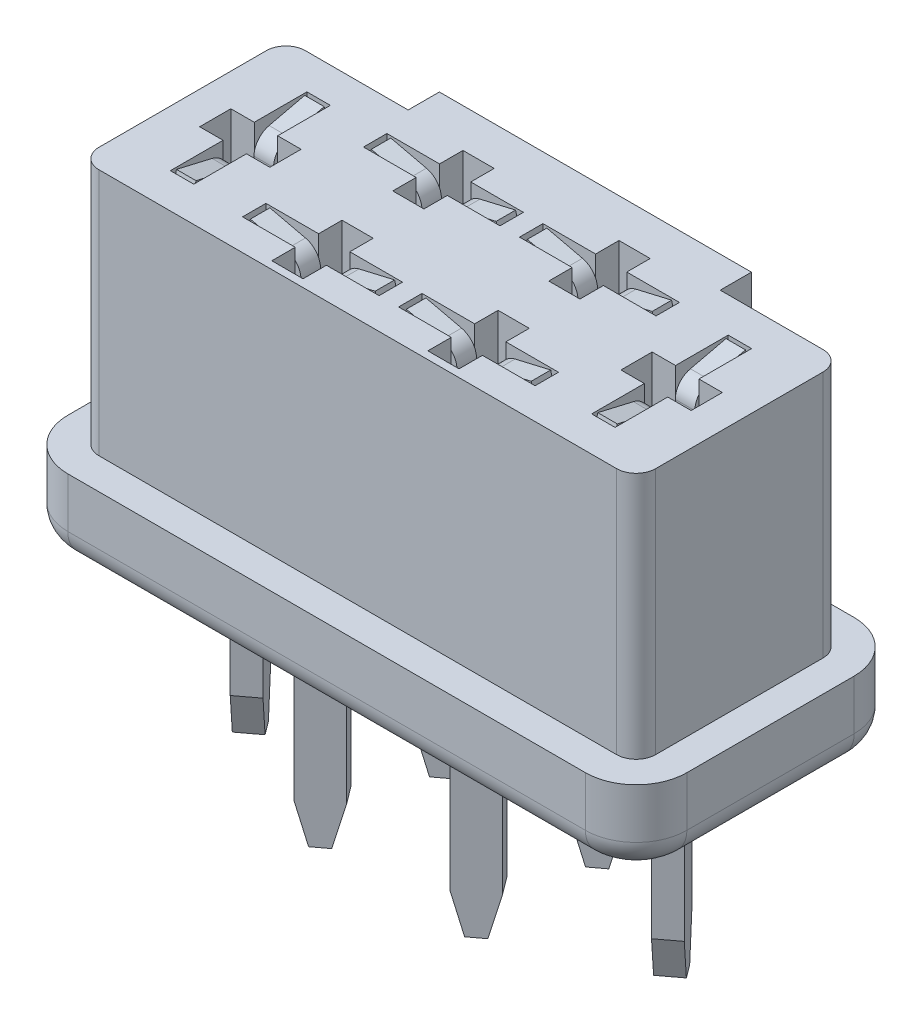
from build123d import *
from OCP.BRepFilletAPI import BRepFilletAPI_MakeChamfer

# Parameters (mm, degrees)
SKETCH1_W            = 15.87
SKETCH1_H            = 6.89
BOSS_EXTRUDE1_DEPTH  = 8.38
FILLET1_R            = 1.3
FILLET2_R            = 0.75
SKETCH2_OUTSIDE_W    = 21.714
SKETCH2_OUTSIDE_H    = 12.734
CUT_EXTRUDE1_DEPTH   = 6.35
CUT_EXTRUDE2_DEPTH   = 3
BOSS_EXTRUDE2_DEPTH  = 4.69
CHAMFER1_SIZE        = 1
CHAMFER1_SIZE2       = 0.267949192
BOSS_EXTRUDE3_DEPTH  = 0.25
MIRROR2_COPY_1_DEPTH = 0.25
BOSS_EXTRUDE4_DEPTH  = 0.25
SKETCH8_W            = 0.769230769
SKETCH8_H            = 0.205128205
BOSS_EXTRUDE5_DEPTH  = 0.15


with BuildPart() as part:
    # Sketch1 → Boss-Extrude1 (new body)
    with BuildSketch(Plane(origin=(0, 0, 0), x_dir=(1, 0, 0), z_dir=(0, 1, 0))):
        Rectangle(SKETCH1_W, SKETCH1_H)
    extrude(amount=BOSS_EXTRUDE1_DEPTH)

    # Fillet1
    fillet1_edges = [part.edges().sort_by_distance(p)[0] for p in [
        (7.935, 4.19, 3.445),
        (-7.935, 4.19, 3.445),
        (-7.935, 4.19, -3.445),
        (7.935, 4.19, -3.445),
    ]]
    fillet(fillet1_edges, radius=FILLET1_R)

    # Fillet2
    fillet2_edges = [part.edges().sort_by_distance(p)[0] for p in [
        (0, 0, 3.445),
        (7.935, 0, 0),
        (-7.935, 0, 0),
        (0, 0, -3.445),
        (7.554238816, 0, 3.064238816),
        (7.554238816, 0, -3.064238816),
        (-7.554238816, 0, -3.064238816),
        (-7.554238816, 0, 3.064238816),
    ]]
    fillet(fillet2_edges, radius=FILLET2_R)

    # Sketch2 outside → Cut-Extrude1 (cut)
    with BuildSketch(Plane(origin=(0, 8.38, 0), x_dir=(1, 0, 0), z_dir=(0, 1, 0))):
        Rectangle(SKETCH2_OUTSIDE_W, SKETCH2_OUTSIDE_H)
        with BuildLine():
            Line((4, 2.645), (4, 3.445))
            Line((4, 3.445), (-4, 3.445))
            Line((-4, 3.445), (-4, 2.645))
            Line((-4, 2.645), (-6.635, 2.645))
            ThreePointArc((-6.635, 2.645), (-6.988553391, 2.498553391), (-7.135, 2.145))
            Line((-7.135, 2.145), (-7.135, -2.145))
            ThreePointArc((-7.135, -2.145), (-6.988553391, -2.498553391), (-6.635, -2.645))
            Line((-6.635, -2.645), (6.635, -2.645))
            ThreePointArc((6.635, -2.645), (6.988553391, -2.498553391), (7.135, -2.145))
            Line((7.135, -2.145), (7.135, 2.145))
            ThreePointArc((7.135, 2.145), (6.988553391, 2.498553391), (6.635, 2.645))
            Line((6.635, 2.645), (4, 2.645))
        make_face(mode=Mode.SUBTRACT)
    extrude(amount=-CUT_EXTRUDE1_DEPTH, mode=Mode.SUBTRACT)

    # Sketch3 → Cut-Extrude2 (cut)
    with BuildSketch(Plane(origin=(0, 8.38, 0), x_dir=(1, 0, 0), z_dir=(0, 1, 0))):
        Polygon((-2.4, -0.65), (-2.4, -1.25), (-3.75, -1.25), (-3.75, -1.85), (-2.4, -1.85), (-2.4, -2.45), (-1.6, -2.45), (-1.6, -1.85), (-0.25, -1.85), (-0.25, -1.25), (-1.6, -1.25), (-1.6, -0.65), align=None)
        Polygon((1.6, -0.65), (2.4, -0.65), (2.4, -1.25), (3.75, -1.25), (3.75, -1.85), (2.4, -1.85), (2.4, -2.45), (1.6, -2.45), (1.6, -1.85), (0.25, -1.85), (0.25, -1.25), (1.6, -1.25), align=None)
        Polygon((2.4, 0.65), (2.4, 1.25), (3.75, 1.25), (3.75, 1.85), (2.4, 1.85), (2.4, 2.45), (1.6, 2.45), (1.6, 1.85), (0.25, 1.85), (0.25, 1.25), (1.6, 1.25), (1.6, 0.65), align=None)
        Polygon((-1.6, 0.65), (-2.4, 0.65), (-2.4, 1.25), (-3.75, 1.25), (-3.75, 1.85), (-2.4, 1.85), (-2.4, 2.45), (-1.6, 2.45), (-1.6, 1.85), (-0.25, 1.85), (-0.25, 1.25), (-1.6, 1.25), align=None)
        Polygon((-5.7, 1.75), (-5.1, 1.75), (-5.1, 0.4), (-4.5, 0.4), (-4.5, -0.4), (-5.1, -0.4), (-5.1, -1.75), (-5.7, -1.75), (-5.7, -0.4), (-6.3, -0.4), (-6.3, 0.4), (-5.7, 0.4), align=None)
        Polygon((5.7, 0.4), (5.7, 1.75), (5.1, 1.75), (5.1, 0.4), (4.5, 0.4), (4.5, -0.4), (5.1, -0.4), (5.1, -1.75), (5.7, -1.75), (5.7, -0.4), (6.3, -0.4), (6.3, 0.4), align=None)
    extrude(amount=-CUT_EXTRUDE2_DEPTH, mode=Mode.SUBTRACT)

    # Sketch5 → Boss-Extrude2 (add)
    with BuildSketch(Plane.XZ):
        Polygon((-5.928, -0.204), (-5.352, 0.564), (-4.872, 0.204), (-5.448, -0.564), align=None)
        Polygon((-2.204, -1.022), (-1.436, -1.598), (-1.796, -2.078), (-2.564, -1.502), align=None)
        Polygon((-2.204, 2.078), (-1.436, 1.502), (-1.796, 1.022), (-2.564, 1.598), align=None)
        Polygon((1.796, 2.078), (2.564, 1.502), (2.204, 1.022), (1.436, 1.598), align=None)
        Polygon((1.796, -1.022), (2.564, -1.598), (2.204, -2.078), (1.436, -1.502), align=None)
        Polygon((4.872, -0.204), (5.448, 0.564), (5.928, 0.204), (5.352, -0.564), align=None)
    extrude(amount=BOSS_EXTRUDE2_DEPTH)

    # Chamfer1: one chamfer whose edges measure the first distance from different faces: ONE call of the kernel's chamfer builder (chamfer() names one face for all edges)
    chamfer1_edges_1 = [part.edges().sort_by_distance(p)[0] for p in [
        (-5.688, -4.69, -0.384),
    ]]
    chamfer1_side_1 = [part.faces().sort_by_distance(p)[0] for p in [
        (-5.688, -2.345, -0.384),
    ]]
    chamfer1_edges_2 = [part.edges().sort_by_distance(p)[0] for p in [
        (-5.112, -4.69, 0.384),
    ]]
    chamfer1_side_2 = [part.faces().sort_by_distance(p)[0] for p in [
        (-5.112, -2.345, 0.384),
    ]]
    chamfer1_edges_3 = [part.edges().sort_by_distance(p)[0] for p in [
        (-2.384, -4.69, -1.262),
    ]]
    chamfer1_side_3 = [part.faces().sort_by_distance(p)[0] for p in [
        (-2.384, -2.345, -1.262),
    ]]
    chamfer1_edges_4 = [part.edges().sort_by_distance(p)[0] for p in [
        (-1.616, -4.69, -1.838),
    ]]
    chamfer1_side_4 = [part.faces().sort_by_distance(p)[0] for p in [
        (-1.616, -2.345, -1.838),
    ]]
    chamfer1_edges_5 = [part.edges().sort_by_distance(p)[0] for p in [
        (-2.384, -4.69, 1.838),
    ]]
    chamfer1_side_5 = [part.faces().sort_by_distance(p)[0] for p in [
        (-2.384, -2.345, 1.838),
    ]]
    chamfer1_edges_6 = [part.edges().sort_by_distance(p)[0] for p in [
        (-1.616, -4.69, 1.262),
    ]]
    chamfer1_side_6 = [part.faces().sort_by_distance(p)[0] for p in [
        (-1.616, -2.345, 1.262),
    ]]
    chamfer1_edges_7 = [part.edges().sort_by_distance(p)[0] for p in [
        (1.616, -4.69, 1.838),
    ]]
    chamfer1_side_7 = [part.faces().sort_by_distance(p)[0] for p in [
        (1.616, -2.345, 1.838),
    ]]
    chamfer1_edges_8 = [part.edges().sort_by_distance(p)[0] for p in [
        (2.384, -4.69, 1.262),
    ]]
    chamfer1_side_8 = [part.faces().sort_by_distance(p)[0] for p in [
        (2.384, -2.345, 1.262),
    ]]
    chamfer1_edges_9 = [part.edges().sort_by_distance(p)[0] for p in [
        (1.616, -4.69, -1.262),
    ]]
    chamfer1_side_9 = [part.faces().sort_by_distance(p)[0] for p in [
        (1.616, -2.345, -1.262),
    ]]
    chamfer1_edges_10 = [part.edges().sort_by_distance(p)[0] for p in [
        (2.384, -4.69, -1.838),
    ]]
    chamfer1_side_10 = [part.faces().sort_by_distance(p)[0] for p in [
        (2.384, -2.345, -1.838),
    ]]
    chamfer1_edges_11 = [part.edges().sort_by_distance(p)[0] for p in [
        (5.112, -4.69, -0.384),
    ]]
    chamfer1_side_11 = [part.faces().sort_by_distance(p)[0] for p in [
        (5.112, -2.345, -0.384),
    ]]
    chamfer1_edges_12 = [part.edges().sort_by_distance(p)[0] for p in [
        (5.688, -4.69, 0.384),
    ]]
    chamfer1_side_12 = [part.faces().sort_by_distance(p)[0] for p in [
        (5.688, -2.345, 0.384),
    ]]
    chamfer1 = BRepFilletAPI_MakeChamfer(part.part.solid().wrapped)
    for e in chamfer1_edges_1:
        chamfer1.Add(CHAMFER1_SIZE, CHAMFER1_SIZE2, e.wrapped, chamfer1_side_1[0].wrapped)  # the first distance lies on this face
    for e in chamfer1_edges_2:
        chamfer1.Add(CHAMFER1_SIZE, CHAMFER1_SIZE2, e.wrapped, chamfer1_side_2[0].wrapped)  # the first distance lies on this face
    for e in chamfer1_edges_3:
        chamfer1.Add(CHAMFER1_SIZE, CHAMFER1_SIZE2, e.wrapped, chamfer1_side_3[0].wrapped)  # the first distance lies on this face
    for e in chamfer1_edges_4:
        chamfer1.Add(CHAMFER1_SIZE, CHAMFER1_SIZE2, e.wrapped, chamfer1_side_4[0].wrapped)  # the first distance lies on this face
    for e in chamfer1_edges_5:
        chamfer1.Add(CHAMFER1_SIZE, CHAMFER1_SIZE2, e.wrapped, chamfer1_side_5[0].wrapped)  # the first distance lies on this face
    for e in chamfer1_edges_6:
        chamfer1.Add(CHAMFER1_SIZE, CHAMFER1_SIZE2, e.wrapped, chamfer1_side_6[0].wrapped)  # the first distance lies on this face
    for e in chamfer1_edges_7:
        chamfer1.Add(CHAMFER1_SIZE, CHAMFER1_SIZE2, e.wrapped, chamfer1_side_7[0].wrapped)  # the first distance lies on this face
    for e in chamfer1_edges_8:
        chamfer1.Add(CHAMFER1_SIZE, CHAMFER1_SIZE2, e.wrapped, chamfer1_side_8[0].wrapped)  # the first distance lies on this face
    for e in chamfer1_edges_9:
        chamfer1.Add(CHAMFER1_SIZE, CHAMFER1_SIZE2, e.wrapped, chamfer1_side_9[0].wrapped)  # the first distance lies on this face
    for e in chamfer1_edges_10:
        chamfer1.Add(CHAMFER1_SIZE, CHAMFER1_SIZE2, e.wrapped, chamfer1_side_10[0].wrapped)  # the first distance lies on this face
    for e in chamfer1_edges_11:
        chamfer1.Add(CHAMFER1_SIZE, CHAMFER1_SIZE2, e.wrapped, chamfer1_side_11[0].wrapped)  # the first distance lies on this face
    for e in chamfer1_edges_12:
        chamfer1.Add(CHAMFER1_SIZE, CHAMFER1_SIZE2, e.wrapped, chamfer1_side_12[0].wrapped)  # the first distance lies on this face
    add(Compound.cast(chamfer1.Shape()), mode=Mode.REPLACE)

    # Sketch6 → Boss-Extrude3 (add, symmetric)
    with BuildSketch(Plane(origin=(0, 0, -1.55), x_dir=(-1, 0, 0), z_dir=(0, 0, -1))):
        with BuildLine():
            Line((-2.3, 5.68), (-1.7, 5.68))
            Line((-1.7, 5.68), (-1.7, 7.68))
            ThreePointArc((-1.7, 7.68), (-1.591652135, 7.990819249), (-1.313565578, 8.166932089))
            Line((-1.313565578, 8.166932089), (-0.4, 8.38))
            Line((-0.4, 8.38), (-0.331860653, 8.087840746))
            Line((-0.331860653, 8.087840746), (-1.245426231, 7.874772836))
            ThreePointArc((-1.245426231, 7.874772836), (-1.356660854, 7.8043277), (-1.4, 7.68))
            Line((-1.4, 7.68), (-1.4, 5.38))
            Line((-1.4, 5.38), (-2.6, 5.38))
            Line((-2.6, 5.38), (-2.6, 7.68))
            ThreePointArc((-2.6, 7.68), (-2.643339146, 7.8043277), (-2.754573769, 7.874772836))
            Line((-2.754573769, 7.874772836), (-3.668139347, 8.087840746))
            Line((-3.668139347, 8.087840746), (-3.6, 8.38))
            Line((-3.6, 8.38), (-2.686434422, 8.166932089))
            ThreePointArc((-2.686434422, 8.166932089), (-2.408347865, 7.990819249), (-2.3, 7.68))
            Line((-2.3, 7.68), (-2.3, 5.68))
        make_face()
    boss_extrude3 = extrude(amount=BOSS_EXTRUDE3_DEPTH, both=True)

    # Mirror1: Boss-Extrude3 across plane
    add(boss_extrude3.mirror(Plane(origin=(0, 0, 0), x_dir=(0, 0, 1), z_dir=(1, 0, 0))))

    # Mirror2: Boss-Extrude3 across plane
    add(boss_extrude3.mirror(Plane.XY))

    # Mirror2 copy 1 sketch → Mirror2 copy 1 (add, symmetric)
    with BuildSketch(Plane.XY.offset(1.55)):
        with BuildLine():
            Line((-2.3, 5.68), (-1.7, 5.68))
            Line((-1.7, 5.68), (-1.7, 7.68))
            ThreePointArc((-1.7, 7.68), (-1.591652135, 7.990819249), (-1.313565578, 8.166932089))
            Line((-1.313565578, 8.166932089), (-0.4, 8.38))
            Line((-0.4, 8.38), (-0.331860653, 8.087840746))
            Line((-0.331860653, 8.087840746), (-1.245426231, 7.874772836))
            ThreePointArc((-1.245426231, 7.874772836), (-1.356660854, 7.8043277), (-1.4, 7.68))
            Line((-1.4, 7.68), (-1.4, 5.38))
            Line((-1.4, 5.38), (-2.6, 5.38))
            Line((-2.6, 5.38), (-2.6, 7.68))
            ThreePointArc((-2.6, 7.68), (-2.643339146, 7.8043277), (-2.754573769, 7.874772836))
            Line((-2.754573769, 7.874772836), (-3.668139347, 8.087840746))
            Line((-3.668139347, 8.087840746), (-3.6, 8.38))
            Line((-3.6, 8.38), (-2.686434422, 8.166932089))
            ThreePointArc((-2.686434422, 8.166932089), (-2.408347865, 7.990819249), (-2.3, 7.68))
            Line((-2.3, 7.68), (-2.3, 5.68))
        make_face()
    extrude(amount=MIRROR2_COPY_1_DEPTH, both=True)

    # Sketch7 → Boss-Extrude4 (add, symmetric)
    with BuildSketch(Plane.ZY.offset(5.4)):
        with BuildLine():
            Line((-0.34356411, 5.68), (0.34356411, 5.68))
            Line((0.34356411, 5.68), (0.34356411, 7.68))
            ThreePointArc((0.34356411, 7.68), (0.451911976, 7.990819249), (0.729998532, 8.166932089))
            Line((0.729998532, 8.166932089), (1.64356411, 8.38))
            Line((1.64356411, 8.38), (1.711703457, 8.087840746))
            Line((1.711703457, 8.087840746), (0.798137879, 7.874772836))
            ThreePointArc((0.798137879, 7.874772836), (0.686903256, 7.8043277), (0.64356411, 7.68))
            Line((0.64356411, 7.68), (0.64356411, 5.38))
            Line((0.64356411, 5.38), (-0.64356411, 5.38))
            Line((-0.64356411, 5.38), (-0.64356411, 7.68))
            ThreePointArc((-0.64356411, 7.68), (-0.686903256, 7.8043277), (-0.798137879, 7.874772836))
            Line((-0.798137879, 7.874772836), (-1.711703457, 8.087840746))
            Line((-1.711703457, 8.087840746), (-1.64356411, 8.38))
            Line((-1.64356411, 8.38), (-0.729998532, 8.166932089))
            ThreePointArc((-0.729998532, 8.166932089), (-0.451911976, 7.990819249), (-0.34356411, 7.68))
            Line((-0.34356411, 7.68), (-0.34356411, 5.68))
        make_face()
    boss_extrude4 = extrude(amount=BOSS_EXTRUDE4_DEPTH, both=True)

    # Mirror3: Boss-Extrude4 across plane
    add(boss_extrude4.mirror(Plane(origin=(0, 0, 0), x_dir=(0, 0, 1), z_dir=(1, 0, 0))))

    # Sketch8 → Boss-Extrude5 (add)
    # profile 1 of 5: a face of its own
    with BuildSketch(Plane.XZ):
        with Locations((-5.483370513, 1.487427858)):
            Rectangle(SKETCH8_W, SKETCH8_H)
    # profile 2 of 5: a face of its own
    with BuildSketch(Plane.XZ):
        Polygon((5.442706084, 1.533944278), (5.442706084, 1.976251971), (5.577321469, 1.976251971), (5.577321469, 1.533944278), (6.019629161, 1.533944278), (6.019629161, 1.399328894), (5.577321469, 1.399328894), (5.577321469, 0.957021201), (5.442706084, 0.957021201), (5.442706084, 1.399328894), (5.000398392, 1.399328894), (5.000398392, 1.533944278), align=None)
    # profile 3 of 5: a face of its own
    with BuildSketch(Plane.XZ):
        Polygon((-0.685537905, 2.086538462), (0.814462095, 1.888521635), (0.814462095, 1.869290865), (-0.416307136, 1.25), (0.814462095, 0.632211538), (0.814462095, 0.612680288), (-0.685537905, 0.413461538), (-0.685537905, 0.548677885), (0.393789018, 0.692307692), (-0.685537905, 1.233774038), (-0.685537905, 1.264122596), (0.396192864, 1.807692308), (-0.685537905, 1.951021635), align=None)
    # profile 4 of 5: a face of its own
    with BuildSketch(Plane.XZ):
        with BuildLine():
            Line((0.814462095, 0.105769231), (0.814462095, -0.188401442))
            add(Edge.make_bspline(
                [(0.814462095, -0.188401442), (0.814439854, -0.208634688), (0.814397239, -0.247402485), (0.813105205, -0.302994651), (0.81137948, -0.353484536), (0.80898724, -0.398763271), (0.80616013, -0.43897017), (0.80219497, -0.473923299), (0.798054843, -0.503897394), (0.793845669, -0.521857301), (0.791926037, -0.530048077)],
                knots=[0, 0, 0, 0, 1.415646017, 2.712440637, 3.8905458, 4.950247383, 5.884950622, 6.709939814, 7.411656543, 8, 8, 8, 8], degree=3))
            add(Edge.make_bspline(
                [(0.791926037, -0.530048077), (0.789088084, -0.540416759), (0.783479051, -0.560909797), (0.772244232, -0.590438462), (0.758924663, -0.618534282), (0.743737948, -0.645285804), (0.72606272, -0.670393235), (0.7064581, -0.694177969), (0.684934872, -0.716776426), (0.661075793, -0.737420944), (0.635760539, -0.756426873), (0.608425328, -0.772731078), (0.579665098, -0.786522282), (0.549185311, -0.797785496), (0.517171213, -0.806349883), (0.483529347, -0.812677522), (0.448375308, -0.816726024), (0.424349139, -0.817111475), (0.412118345, -0.817307692)],
                knots=[0, 0, 0, 0, 0.999487232, 1.975422798, 2.933948774, 3.889618007, 4.832992075, 5.786114792, 6.754729845, 7.731954186, 8.717668599, 9.695514499, 10.68728626, 11.680675814, 12.71351902, 13.766008651, 14.862761406, 16, 16, 16, 16], degree=3))
            add(Edge.make_bspline(
                [(0.412118345, -0.817307692), (0.399785012, -0.817127082), (0.375654013, -0.816773705), (0.34035139, -0.81253244), (0.306614937, -0.8068195), (0.274519458, -0.798035049), (0.244255557, -0.786529761), (0.215360743, -0.773033167), (0.188326598, -0.756754511), (0.163054976, -0.738049584), (0.139522156, -0.717241758), (0.117898673, -0.69441907), (0.098311099, -0.669673659), (0.080715524, -0.643084167), (0.065519975, -0.614391375), (0.051909702, -0.584030452), (0.040479247, -0.551737502), (0.034466364, -0.52939071), (0.031409211, -0.518028846)],
                knots=[0, 0, 0, 0, 1.121902311, 2.195077645, 3.232258892, 4.234102512, 5.217864754, 6.176164875, 7.132989551, 8.084763148, 9.034132444, 9.988522005, 10.94243251, 11.903244335, 12.886203696, 13.894208494, 14.929344452, 16, 16, 16, 16], degree=3))
            add(Edge.make_bspline(
                [(0.031409211, -0.518028846), (0.02941079, -0.508631417), (0.025031135, -0.488036406), (0.020141797, -0.454118096), (0.015968539, -0.414627216), (0.01283948, -0.369617668), (0.010160751, -0.319129851), (0.008031568, -0.263136455), (0.006861631, -0.201527565), (0.006801291, -0.158554175), (0.006769787, -0.136117788)],
                knots=[0, 0, 0, 0, 0.601384939, 1.31797006, 2.144135048, 3.087295005, 4.142315834, 5.309527816, 6.595305764, 8, 8, 8, 8], degree=3))
            Line((0.006769787, -0.136117788), (0.006769787, -0.028846154))
            Line((0.006769787, -0.028846154), (-0.685537905, -0.028846154))
            Line((-0.685537905, -0.028846154), (-0.685537905, 0.105769231))
            Line((-0.685537905, 0.105769231), (0.814462095, 0.105769231))
        make_face()
        with BuildLine():
            Line((0.660615941, -0.028846154), (0.160615941, -0.028846154))
            Line((0.160615941, -0.028846154), (0.157310653, -0.291466346))
            add(Edge.make_bspline(
                [(0.157310653, -0.291466346), (0.157302634, -0.304289297), (0.157287154, -0.329043739), (0.159018542, -0.364900309), (0.160928379, -0.398081594), (0.163919265, -0.428659652), (0.16786004, -0.456400803), (0.172149497, -0.481661374), (0.177960858, -0.504071563), (0.186063877, -0.530332201), (0.199614387, -0.559495242), (0.219790106, -0.591010898), (0.244801561, -0.618152302), (0.273309526, -0.641482376), (0.305138776, -0.659563122), (0.338927011, -0.673162148), (0.37469549, -0.681083502), (0.399159975, -0.682152393), (0.411517384, -0.682692308)],
                knots=[0, 0, 0, 0, 1.160368111, 2.240066715, 3.248291599, 4.168343349, 5.019594299, 5.784185847, 6.485545725, 7.113397927, 8.269509094, 9.383373363, 10.487084095, 11.595623793, 12.704274681, 13.786671823, 14.88201193, 16, 16, 16, 16], degree=3))
            add(Edge.make_bspline(
                [(0.411517384, -0.682692308), (0.423575809, -0.68214951), (0.447546467, -0.681070496), (0.482694048, -0.673099665), (0.516123802, -0.659589668), (0.547561195, -0.641359858), (0.57595249, -0.618699665), (0.600399476, -0.59215974), (0.620319477, -0.562282012), (0.633087986, -0.534474932), (0.640897047, -0.509790901), (0.646358512, -0.488348102), (0.650719679, -0.464137981), (0.654250835, -0.437151738), (0.657273765, -0.407598825), (0.659324893, -0.375225256), (0.660525519, -0.340153696), (0.660585071, -0.315806309), (0.660615941, -0.303185096)],
                knots=[0, 0, 0, 0, 1.120550889, 2.227516482, 3.330715807, 4.461473166, 5.594337325, 6.694900473, 7.802844763, 8.919519911, 9.52614448, 10.208195984, 10.975273469, 11.811520316, 12.738076669, 13.736566072, 14.826679847, 16, 16, 16, 16], degree=3))
            Line((0.660615941, -0.303185096), (0.660615941, -0.028846154))
        make_face(mode=Mode.SUBTRACT)
    # profile 5 of 5: a face of its own
    with BuildSketch(Plane.XZ):
        Polygon((0.814462095, -1.019230769), (0.814462095, -1.174579327), (0.200880364, -1.567307692), (0.814462095, -1.960036058), (0.814462095, -2.115384615), (0.079486134, -1.645132212), (-0.685537905, -2.134615385), (-0.685537905, -1.979266827), (-0.041908097, -1.567307692), (-0.685537905, -1.155348558), (-0.685537905, -1), (0.079486134, -1.489783654), align=None)
    extrude(amount=BOSS_EXTRUDE5_DEPTH)


solid = part.part
